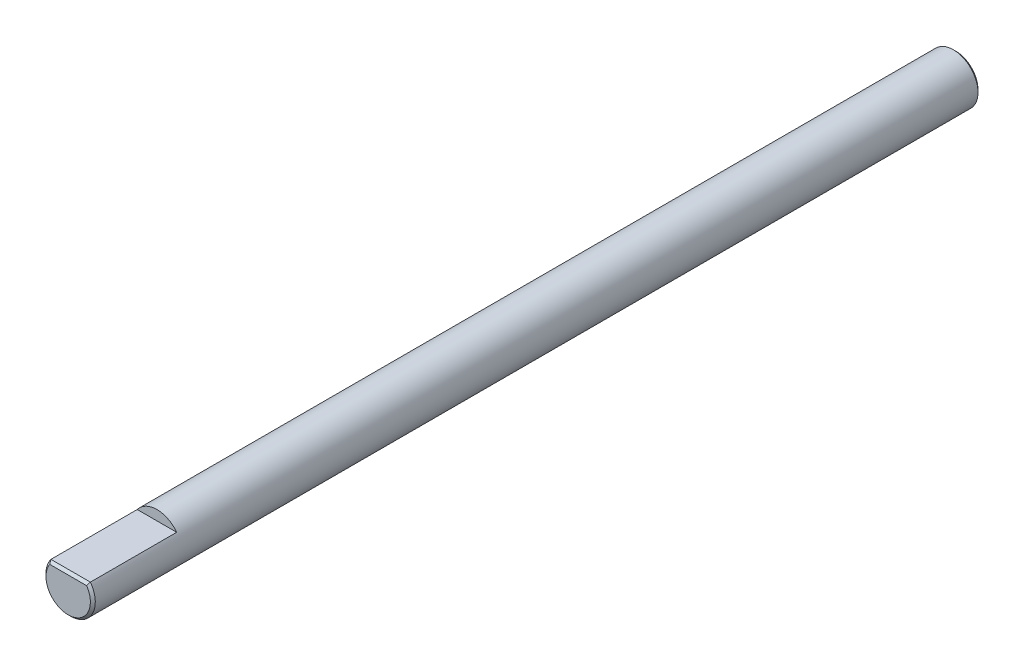
from build123d import *

# Parameters (mm, degrees)
SKETCH1_R           = 2.5
BOSS_EXTRUDE1_DEPTH = 90
CUT_EXTRUDE1_DEPTH  = 9
CHAMFER1_SIZE       = 0.25


with BuildPart() as part:
    # Sketch1 → Boss-Extrude1 (new body)
    with BuildSketch(Plane.XY):
        with Locations(Location((0, 0, 0), (0, 0, 180))):
            Circle(SKETCH1_R)
    extrude(amount=BOSS_EXTRUDE1_DEPTH)

    # Sketch2 → Cut-Extrude1 (cut)
    with BuildSketch(Plane.XY.offset(90)):
        with BuildLine():
            Line((-2.454110015, 1.5), (2.151792115, 1.5))
            ThreePointArc((2.151792115, 1.5), (-0.15115895, 4.391411645), (-2.454110015, 1.5))
        make_face()
    extrude(amount=-CUT_EXTRUDE1_DEPTH, mode=Mode.SUBTRACT)

    # Chamfer1
    chamfer1_edges = [part.edges().sort_by_distance(p)[0] for p in [
        (2.5, 0, 0),
        (0.790569415, -2.371708245, 90),
        (0, 1.5, 90),
    ]]
    chamfer(chamfer1_edges, length=CHAMFER1_SIZE)


solid = part.part
